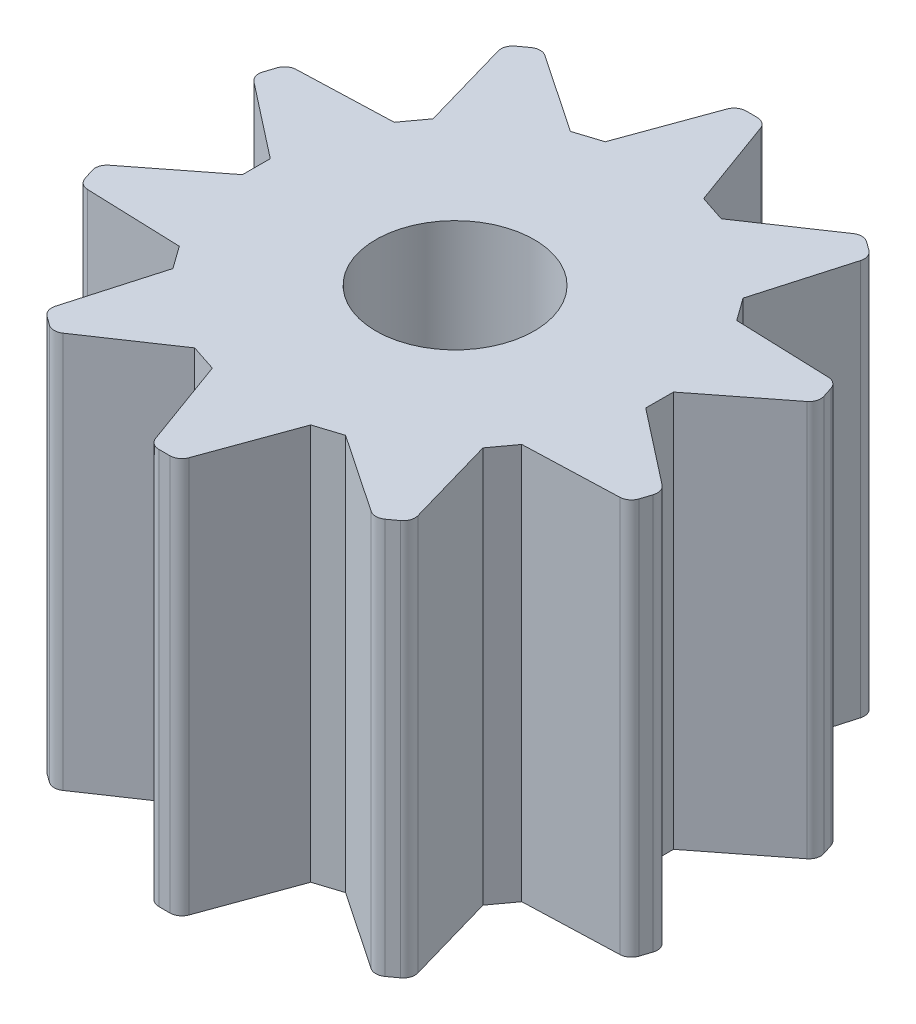
from build123d import *

# Parameters (mm, degrees)
SKETCH2_R           = 2
BOSS_EXTRUDE1_DEPTH = 10
FILLET1_R           = 0.3


with BuildPart() as part:
    # Sketch2 → Boss-Extrude1 (new body)
    with BuildSketch(Plane(origin=(0, 0, 0), x_dir=(1, 0, 0), z_dir=(0, 1, 0))):
        Polygon((-0.35, 7.485859039), (0.35, 7.485859039), (1.242069669, 5.034917766), (1.906773221, 4.815442965), (4.069099878, 6.273950712), (4.635411774, 5.862501035), (3.916484162, 3.355302497), (4.325236581, 2.787040708), (6.931884937, 2.696014542), (7.148196833, 2.03027498), (5.092877853, 0.424483803), (5.089549606, -0.275508285), (7.144868587, -1.881299462), (6.928556691, -2.547039024), (4.321908334, -2.63806519), (3.907770701, -3.202414391), (4.626698313, -5.709612929), (4.060386417, -6.121062606), (1.898059759, -4.662554859), (1.231299238, -4.87569896), (0.339229569, -7.326640233), (-0.360770431, -7.326640233), (-1.2528401, -4.87569896), (-1.917543652, -4.656224159), (-4.079870309, -6.114731905), (-4.646182205, -5.703282228), (-3.927254593, -3.196083691), (-4.336007012, -2.627821902), (-6.942655368, -2.536795735), (-7.158967264, -1.871056174), (-5.103648284, -0.265264996), (-5.100320037, 0.434727091), (-7.155639018, 2.040518269), (-6.939327122, 2.70625783), (-4.332678765, 2.797283997), (-3.918541132, 3.361633198), (-4.637468744, 5.868831735), (-4.071156848, 6.280281412), (-1.90883019, 4.821773666), (-1.242069669, 5.034917766), align=None)
        with Locations(Location((0, 0, 0), (0, 0, 270))):
            Circle(SKETCH2_R, mode=Mode.SUBTRACT)
    extrude(amount=BOSS_EXTRUDE1_DEPTH)

    # Fillet1
    fillet1_edges = [part.edges().sort_by_distance(p)[0] for p in [
        (-0.35, 5, -7.485859039),
        (0.35, 5, -7.485859039),
        (4.069099878, 5, -6.273950712),
        (4.635411774, 5, -5.862501035),
        (6.931884937, 5, -2.696014542),
        (7.148196833, 5, -2.03027498),
        (7.144868587, 5, 1.881299462),
        (6.928556691, 5, 2.547039024),
        (4.626698313, 5, 5.709612929),
        (4.060386417, 5, 6.121062606),
        (0.339229569, 5, 7.326640233),
        (-0.360770431, 5, 7.326640233),
        (-4.079870309, 5, 6.114731905),
        (-4.646182205, 5, 5.703282228),
        (-6.942655368, 5, 2.536795735),
        (-7.158967264, 5, 1.871056174),
        (-7.155639018, 5, -2.040518269),
        (-6.939327122, 5, -2.70625783),
        (-4.637468744, 5, -5.868831735),
        (-4.071156848, 5, -6.280281412),
    ]]
    fillet(fillet1_edges, radius=FILLET1_R)


solid = part.part
